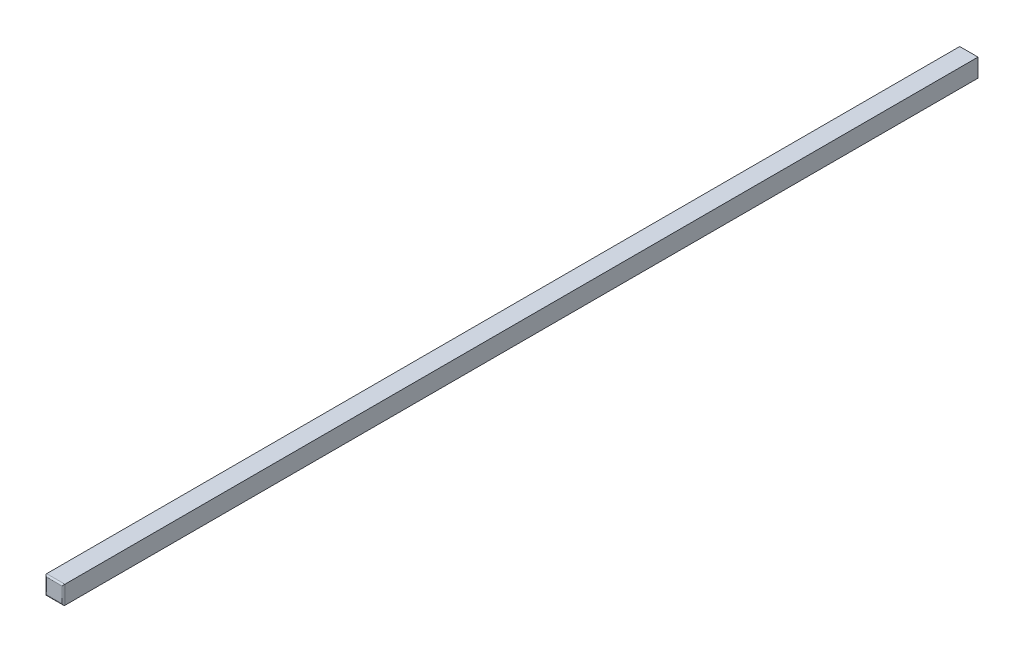
from build123d import *

# Parameters (mm, degrees)
SKETCH3_W           = 6
SKETCH3_H           = 6
BOSS_EXTRUDE1_DEPTH = 150
FILLET1_R           = 0.5


with BuildPart() as part:
    # Sketch3 → Boss-Extrude1 (new, symmetric)
    with BuildSketch(Plane.XY):
        Rectangle(SKETCH3_W, SKETCH3_H)
    extrude(amount=BOSS_EXTRUDE1_DEPTH, both=True)

    # Fillet1
    fillet1_edges = [part.edges().sort_by_distance(p)[0] for p in [
        (3, 0, 150),
        (0, 3, 150),
        (-3, 0, 150),
        (0, -3, 150),
    ]]
    fillet(fillet1_edges, radius=FILLET1_R)


solid = part.part
